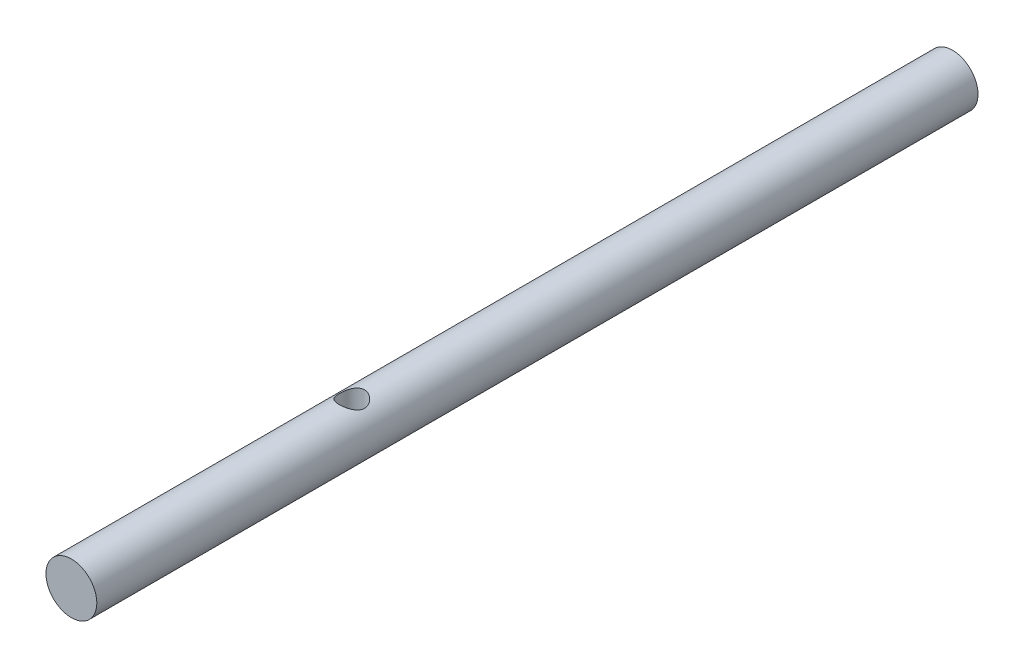
from build123d import *

# Parameters (mm, degrees)
SKETCH1_R               = 1.5875
BOSS_EXTRUDE1_DEPTH     = 27.5
CUT_EXTRUDE1_DEPTH      = 28.591489856
CUT_EXTRUDE1_DEPTH_BACK = 28.591489856
SKETCH2_R               = 0.79375


with BuildPart() as part:
    # Sketch1 → Boss-Extrude1 (new, symmetric)
    with BuildSketch(Plane.XY):
        Circle(SKETCH1_R)
    extrude(amount=BOSS_EXTRUDE1_DEPTH, both=True)

    # Sketch2 → Cut-Extrude1 (cut, two sides: drawn at the far end of the back side and taken through both)
    with BuildSketch(Plane(origin=(0, 0, 0), x_dir=(1, 0, 0), z_dir=(0, 1, 0)).offset(-CUT_EXTRUDE1_DEPTH_BACK)):
        with Locations(Location((0, -10, 0), (0, 0, 270))):
            Circle(SKETCH2_R)
    extrude(amount=CUT_EXTRUDE1_DEPTH + CUT_EXTRUDE1_DEPTH_BACK, mode=Mode.SUBTRACT)


solid = part.part
